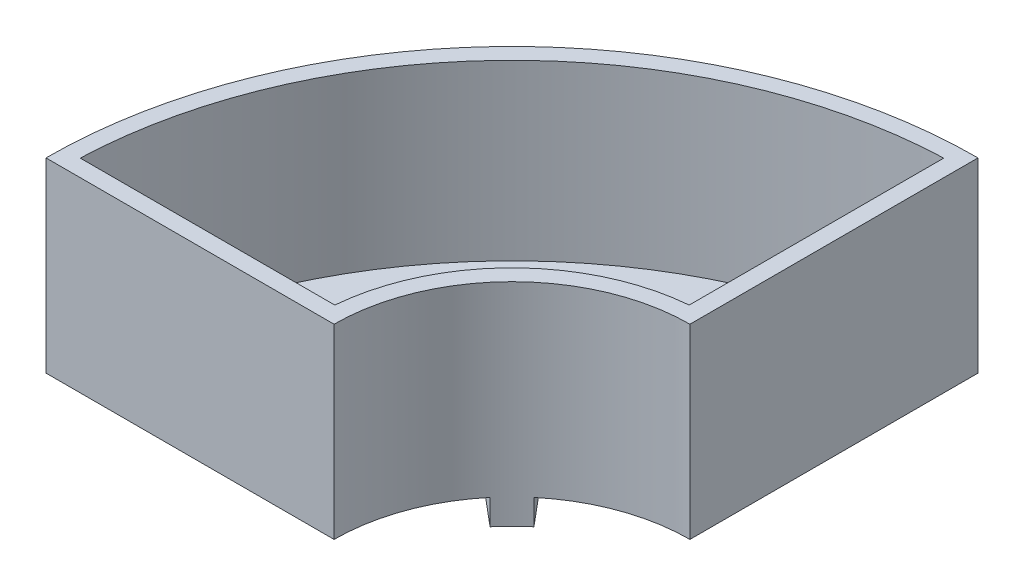
from build123d import *

# Parameters (mm, degrees)
ESTRUSIONE_ESTRUSIONE1_DEPTH = 3
ESTRUSIONE_SOTTILE1_DEPTH    = 44
ESTRUSIONE_ESTRUSIONE2_START = 6
ESTRUSIONE_ESTRUSIONE2_DEPTH = 6


with BuildPart() as part:
    # Schizzo1 → Estrusione-Estrusione1 (new body)
    with BuildSketch(Plane(origin=(0, 0, 0), x_dir=(1, 0, 0), z_dir=(0, 1, 0))):
        with BuildLine():
            Line((-110, 0), (-42, 0))
            ThreePointArc((-42, 0), (-29.69848481, 29.69848481), (0, 42))
            Line((0, 42), (0, 110))
            ThreePointArc((0, 110), (-77.781745931, 77.781745931), (-110, 0))
        make_face()
    extrude(amount=ESTRUSIONE_ESTRUSIONE1_DEPTH)

    # Schizzo1<2> → Estrusione-Sottile1 (add)
    with BuildSketch(Plane(origin=(0, 0, 0), x_dir=(1, 0, 0), z_dir=(0, 1, 0))):
        with BuildLine():
            Line((0, 42), (0, 110))
            ThreePointArc((0, 110), (-77.781745931, 77.781745931), (-110, 0))
            Line((-110, 0), (-42, 0))
            ThreePointArc((-42, 0), (-29.69848481, 29.69848481), (0, 42))
        make_face()
        with BuildLine():
            Line((-4, 45.82575695), (-4, 105.924501415))
            ThreePointArc((-4, 105.924501415), (-74.953318806, 74.953318806), (-105.924501415, 4))
            Line((-105.924501415, 4), (-45.82575695, 4))
            ThreePointArc((-45.82575695, 4), (-32.526911935, 32.526911935), (-4, 45.82575695))
        make_face(mode=Mode.SUBTRACT)
    extrude(amount=ESTRUSIONE_SOTTILE1_DEPTH)

    # Schizzo2 → Estrusione-Estrusione2 (add)
    with BuildSketch(Plane.XZ.offset(ESTRUSIONE_ESTRUSIONE2_START)):
        with BuildLine():
            Line((-84.264888743, -70.706637066), (-32.173866611, -26.997079607))
            ThreePointArc((-32.173866611, -26.997079607), (-29.69848481, -29.69848481), (-26.997079607, -32.173866611))
            Line((-26.997079607, -32.173866611), (-70.706637066, -84.264888743))
            ThreePointArc((-70.706637066, -84.264888743), (-77.781745931, -77.781745931), (-84.264888743, -70.706637066))
        make_face()
    extrude(amount=-ESTRUSIONE_ESTRUSIONE2_DEPTH)


solid = part.part
